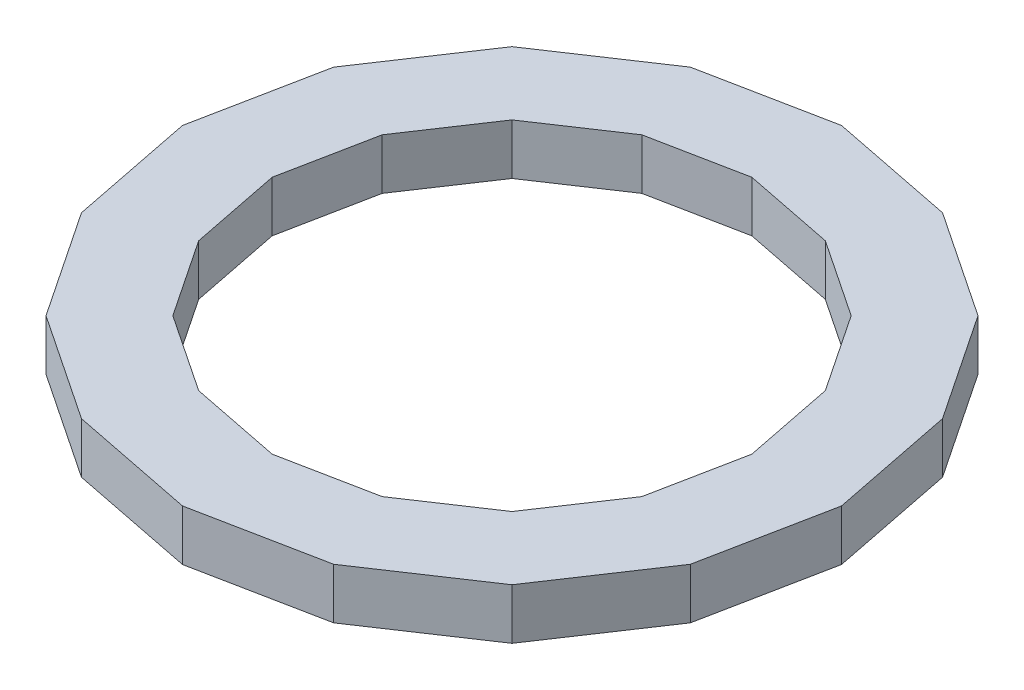
from build123d import *

# Parameters (mm, degrees)
BOSS_EXTRUDE1_DEPTH = 19.05


with BuildPart() as part:
    # Sketch1 → Boss-Extrude1 (new body)
    with BuildSketch(Plane(origin=(0, 0, 0), x_dir=(1, 0, 0), z_dir=(0, 1, 0))):
        Polygon((123.686299508, 0), (114.271240568, 47.332697632), (87.459421122, 87.459421122), (47.332697632, 114.271240568), (0, 123.686299508), (-47.332697632, 114.271240568), (-87.459421122, 87.459421122), (-114.271240568, 47.332697632), (-123.686299508, 0), (-114.271240568, -47.332697632), (-87.459421122, -87.459421122), (-47.332697632, -114.271240568), (0, -123.686299508), (47.332697632, -114.271240568), (87.459421122, -87.459421122), (114.271240568, -47.332697632), align=None)
        Polygon((90.019399464, 0), (83.167080694, 34.448932766), (63.653327799, 63.653327799), (34.448932766, 83.167080694), (0, 90.019399464), (-34.448932766, 83.167080694), (-63.653327799, 63.653327799), (-83.167080694, 34.448932766), (-90.019399464, 0), (-83.167080694, -34.448932766), (-63.653327799, -63.653327799), (-34.448932766, -83.167080694), (0, -90.019399464), (34.448932766, -83.167080694), (63.653327799, -63.653327799), (83.167080694, -34.448932766), align=None, mode=Mode.SUBTRACT)
    extrude(amount=BOSS_EXTRUDE1_DEPTH)


solid = part.part
